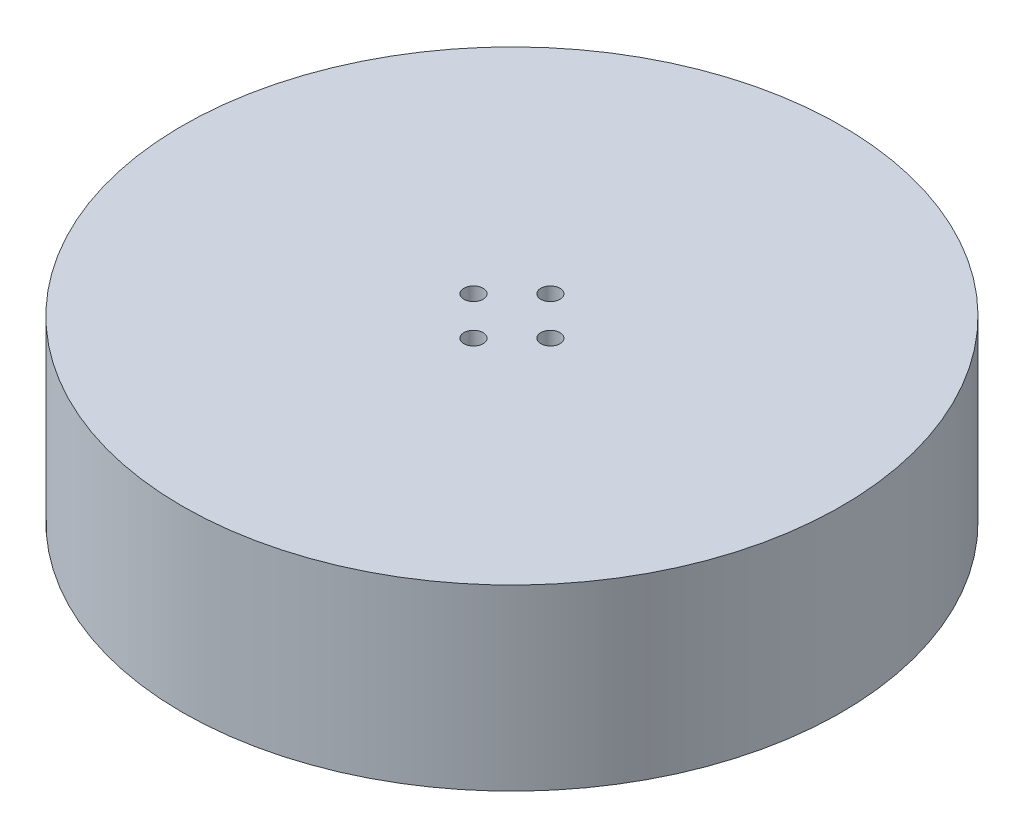
from build123d import *

# Parameters (mm, degrees)
SKETCH_1_R          = 60
EXTRUDE_1_DEPTH     = 32.5
SKETCH_2_R          = 1.75
CUT_EXTRUDE_1_DEPTH = 10


with BuildPart() as part:
    # 草图1 → 凸台-拉伸1 (new body)
    with BuildSketch(Plane(origin=(0, 0, 0), x_dir=(1, 0, 0), z_dir=(0, 1, 0))):
        with Locations(Location((0, 0, 0), (0, 0, 270))):
            Circle(SKETCH_1_R)
    extrude(amount=EXTRUDE_1_DEPTH)

    # 草图2 → 切除-拉伸1 (cut)
    with BuildSketch(Plane(origin=(0, 32.5, 0), x_dir=(1, 0, 0), z_dir=(0, 1, 0))):
        with Locations(Location((7, 0, 0), (0, 0, 270))):
            Circle(SKETCH_2_R)
        with Locations(Location((0, -7, 0), (0, 0, 270))):
            Circle(SKETCH_2_R)
        with Locations(Location((-7, 0, 0), (0, 0, 270))):
            Circle(SKETCH_2_R)
        with Locations(Location((0, 7, 0), (0, 0, 270))):
            Circle(SKETCH_2_R)
    extrude(amount=-CUT_EXTRUDE_1_DEPTH, mode=Mode.SUBTRACT)


solid = part.part
